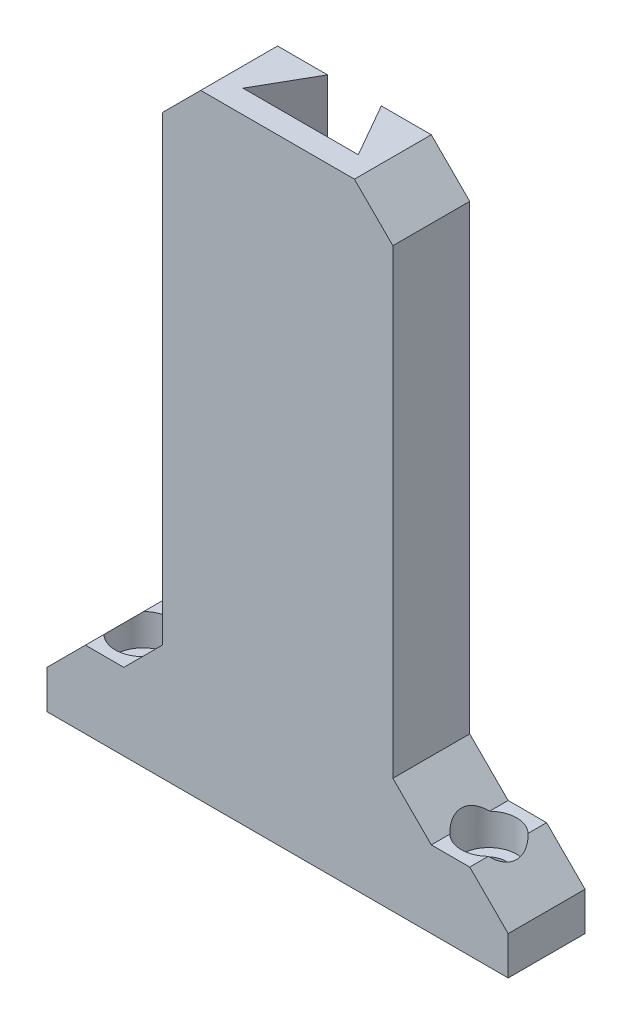
from build123d import *

# Parameters (mm, degrees)
SKETCH1_W               = 30
SKETCH1_H               = 70
SKETCH1_W_2             = 15
SKETCH1_H_2             = 10
BOSS_EXTRUDE1_DEPTH     = 10
CHAMFER1_SIZE           = 5
CUT_EXTRUDE1_DEPTH      = 213
SKETCH3_R               = 2.1
CUT_EXTRUDE2_DEPTH      = 213
CUT_EXTRUDE3_DEPTH      = 213
CUT_EXTRUDE3_DEPTH_BACK = 4.1
SKETCH4_R               = 3.6


with BuildPart() as part:
    # Sketch1 → Boss-Extrude1 (new body)
    with BuildSketch(Plane.XY):
        with Locations((0, 40)):
            Rectangle(SKETCH1_W, SKETCH1_H)
        with Locations((22.5, 0)):
            Rectangle(SKETCH1_W_2, SKETCH1_H_2)
        Rectangle(SKETCH1_W, SKETCH1_H_2)
        with Locations((-22.5, 0)):
            Rectangle(SKETCH1_W_2, SKETCH1_H_2)
    extrude(amount=BOSS_EXTRUDE1_DEPTH)

    # Chamfer1
    chamfer1_edges = [part.edges().sort_by_distance(p)[0] for p in [
        (-15, 75, 5),
        (15, 75, 5),
        (15, 5, 5),
        (30, 5, 5),
        (-30, 5, 5),
        (-15, 5, 5),
    ]]
    chamfer(chamfer1_edges, length=CHAMFER1_SIZE)

    # Sketch2 → Cut-Extrude1 (cut)
    with BuildSketch(Plane(origin=(0, 75, 0), x_dir=(1, 0, 0), z_dir=(0, 1, 0))):
        Polygon((7.500239939, -7), (-7.500239939, -7), (-3.5, 0), (3.5, 0), align=None)
    extrude(amount=-CUT_EXTRUDE1_DEPTH, mode=Mode.SUBTRACT)

    # Sketch3 → Cut-Extrude2 (cut)
    with BuildSketch(Plane(origin=(0, 5, 0), x_dir=(1, 0, 0), z_dir=(0, 1, 0))):
        with Locations(Location((22.5, -5, 0), (0, 0, 180))):
            Circle(SKETCH3_R)
        with Locations((-22.5, -5)):
            Circle(SKETCH3_R)
    extrude(amount=-CUT_EXTRUDE2_DEPTH, mode=Mode.SUBTRACT)

    # Sketch4 → Cut-Extrude3 (cut, two sides: drawn at the far end of the back side and taken through both)
    with BuildSketch(Plane(origin=(0, 5, 0), x_dir=(1, 0, 0), z_dir=(0, 1, 0)).offset(-CUT_EXTRUDE3_DEPTH_BACK)):
        with Locations(Location((22.5, -5, 0), (0, 0, 46.01703687))):
            Circle(SKETCH4_R)
        with Locations((-22.5, -5)):
            Circle(SKETCH4_R)
    extrude(amount=CUT_EXTRUDE3_DEPTH + CUT_EXTRUDE3_DEPTH_BACK, mode=Mode.SUBTRACT)


solid = part.part
